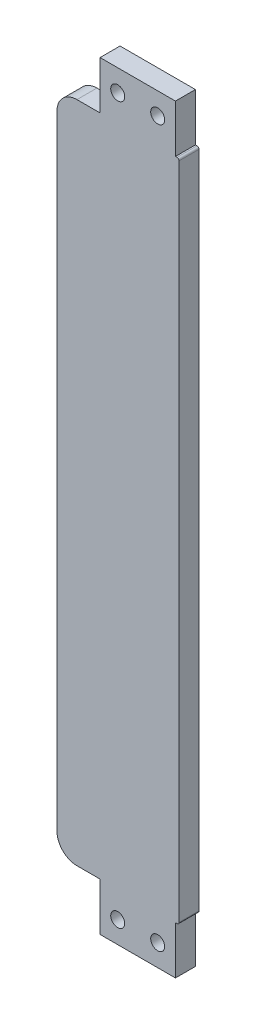
from build123d import *

# Parameters (mm, degrees)
SKETCH1_R           = 1.75
BOSS_EXTRUDE1_DEPTH = 5


with BuildPart() as part:
    # Sketch1 → Boss-Extrude1 (new body)
    with BuildSketch(Plane.XY):
        with BuildLine():
            Line((-20.194136312, -20), (-20.194136312, -176))
            ThreePointArc((-20.194136312, -176), (-18.729670218, -179.535533906), (-15.194136312, -181))
            Line((-15.194136312, -181), (-9.446581599, -181))
            Line((-9.446581599, -181), (-9.446581599, -193))
            Line((-9.446581599, -193), (9.446581599, -193))
            Line((9.446581599, -193), (9.446581599, -181))
            Line((9.446581599, -181), (9.846581599, -181))
            ThreePointArc((9.846581599, -181), (10.200134989, -180.853553391), (10.346581599, -180.5))
            Line((10.346581599, -180.5), (10.346581599, -15.5))
            ThreePointArc((10.346581599, -15.5), (10.200134989, -15.146446609), (9.846581599, -15))
            Line((9.846581599, -15), (9.446581599, -15))
            Line((9.446581599, -15), (9.446581599, -3))
            Line((9.446581599, -3), (-9.413759597, -3))
            Line((-9.413759597, -3), (-9.413759597, -15))
            Line((-9.413759597, -15), (-15.194136312, -15))
            ThreePointArc((-15.194136312, -15), (-18.729670218, -16.464466094), (-20.194136312, -20))
        make_face()
        with Locations((-5, -187.570297721)):
            Circle(SKETCH1_R, mode=Mode.SUBTRACT)
        with Locations((5, -187.570297721)):
            Circle(SKETCH1_R, mode=Mode.SUBTRACT)
        with Locations((-5, -8.429702279)):
            Circle(SKETCH1_R, mode=Mode.SUBTRACT)
        with Locations((5, -8.429702279)):
            Circle(SKETCH1_R, mode=Mode.SUBTRACT)
    extrude(amount=BOSS_EXTRUDE1_DEPTH)


solid = part.part
